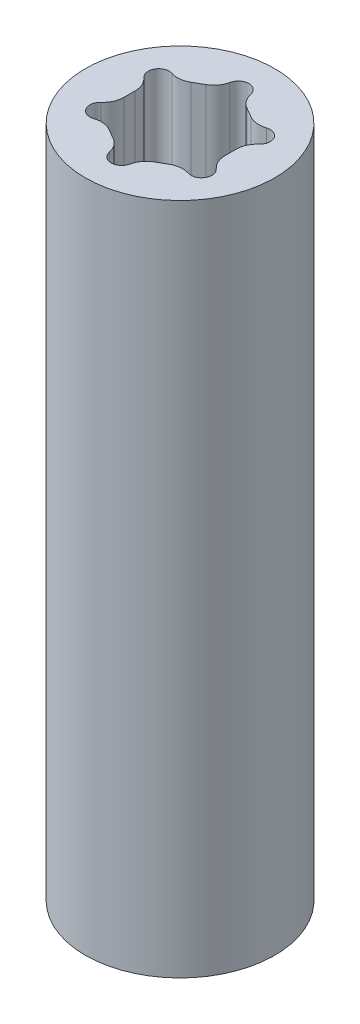
from build123d import *

# Parameters (mm, degrees)
SKETCH1_R                      = 4.5
BOSS_EXTRUDE1_DEPTH            = 32
SKETCH1_4_R                    = 4.5
BOSS_EXTRUDE2_DEPTH            = 9
M3_CLEARANCE_HOLE1_D           = 3.6
M3_CLEARANCE_HOLE1_CSINK_D     = 3.65
M3_CLEARANCE_HOLE1_CSINK_ANGLE = 90
FILLET1_R                      = 1


with BuildPart() as part:
    # Sketch1 → Boss-Extrude1 (new body)
    with BuildSketch(Plane(origin=(0, 0, 0), x_dir=(1, 0, 0), z_dir=(0, 1, 0))):
        Circle(SKETCH1_R)
        with BuildLine():
            Line((-2.4, -0.885640646), (-2.4, 0.885640646))
            ThreePointArc((-2.4, 0.885640646), (-2.833012702, 1.635640646), (-1.966987298, 1.635640646))
            Line((-1.966987298, 1.635640646), (-0.433012702, 2.521281292))
            ThreePointArc((-0.433012702, 2.521281292), (-0.129409523, 3.254244205), (0.5, 2.771281292))
            ThreePointArc((0.5, 2.771281292), (0.482962913, 2.64187177), (0.433012702, 2.521281292))
            Line((0.433012702, 2.521281292), (1.966987298, 1.635640646))
            ThreePointArc((1.966987298, 1.635640646), (2.529409523, 1.868603559), (2.9, 1.385640646))
            ThreePointArc((2.9, 1.385640646), (2.753553391, 1.032087255), (2.4, 0.885640646))
            Line((2.4, 0.885640646), (2.4, -0.885640646))
            ThreePointArc((2.4, -0.885640646), (2.753553391, -1.032087255), (2.9, -1.385640646))
            ThreePointArc((2.9, -1.385640646), (2.529409523, -1.868603559), (1.966987298, -1.635640646))
            Line((1.966987298, -1.635640646), (0.433012702, -2.521281292))
            ThreePointArc((0.433012702, -2.521281292), (0.482962913, -2.64187177), (0.5, -2.771281292))
            ThreePointArc((0.5, -2.771281292), (-0.129409523, -3.254244205), (-0.433012702, -2.521281292))
            Line((-0.433012702, -2.521281292), (-1.966987298, -1.635640646))
            ThreePointArc((-1.966987298, -1.635640646), (-2.833012702, -1.635640646), (-2.4, -0.885640646))
        make_face(mode=Mode.SUBTRACT)
    extrude(amount=BOSS_EXTRUDE1_DEPTH)

    # Sketch1<4> → Boss-Extrude2 (add)
    with BuildSketch(Plane(origin=(0, 0, 0), x_dir=(1, 0, 0), z_dir=(0, 1, 0))):
        Circle(SKETCH1_4_R)
    extrude(amount=BOSS_EXTRUDE2_DEPTH)

    # M3 Clearance Hole1 (through all)
    with Locations(Plane(origin=(0, 0, 0), x_dir=(-1, 0, 0), z_dir=(0, -1, 0))):
        with Locations((0, 0)):
            CounterSinkHole(M3_CLEARANCE_HOLE1_D / 2, M3_CLEARANCE_HOLE1_CSINK_D / 2, counter_sink_angle=M3_CLEARANCE_HOLE1_CSINK_ANGLE)

    # Fillet1
    fillet1_edges = [part.edges().sort_by_distance(p)[0] for p in [
        (-2.4, 20.5, -0.885640646),
        (-2.4, 20.5, 0.885640646),
        (-1.966987298, 20.5, 1.635640646),
        (-0.433012702, 20.5, 2.521281292),
        (1.966987298, 20.5, 1.635640646),
        (2.4, 20.5, 0.885640646),
        (2.4, 20.5, -0.885640646),
        (1.966987298, 20.5, -1.635640646),
        (0.433012702, 20.5, -2.521281292),
        (-0.433012702, 20.5, -2.521281292),
        (-1.966987298, 20.5, -1.635640646),
        (0.433012702, 20.5, 2.521281292),
    ]]
    fillet(fillet1_edges, radius=FILLET1_R)


solid = part.part
